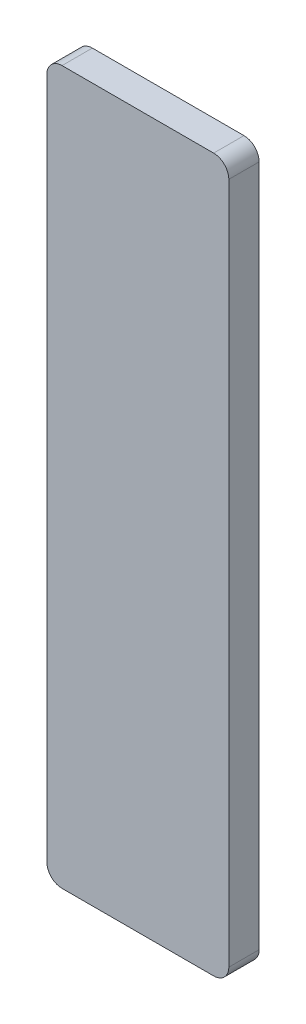
from build123d import *

# Parameters (mm, degrees)
BOSS_EXTRUDE1_DEPTH = 20


with BuildPart() as part:
    # Sketch1 → Boss-Extrude1 (new body)
    with BuildSketch(Plane.XY):
        with BuildLine():
            Line((-50, -235), (50, -235))
            ThreePointArc((50, -235), (57.071067812, -232.071067812), (60, -225))
            Line((60, -225), (60, 225))
            ThreePointArc((60, 225), (57.071067812, 232.071067812), (50, 235))
            Line((50, 235), (-50, 235))
            ThreePointArc((-50, 235), (-57.071067812, 232.071067812), (-60, 225))
            Line((-60, 225), (-60, -225))
            ThreePointArc((-60, -225), (-57.071067812, -232.071067812), (-50, -235))
        make_face()
    extrude(amount=BOSS_EXTRUDE1_DEPTH)


solid = part.part
